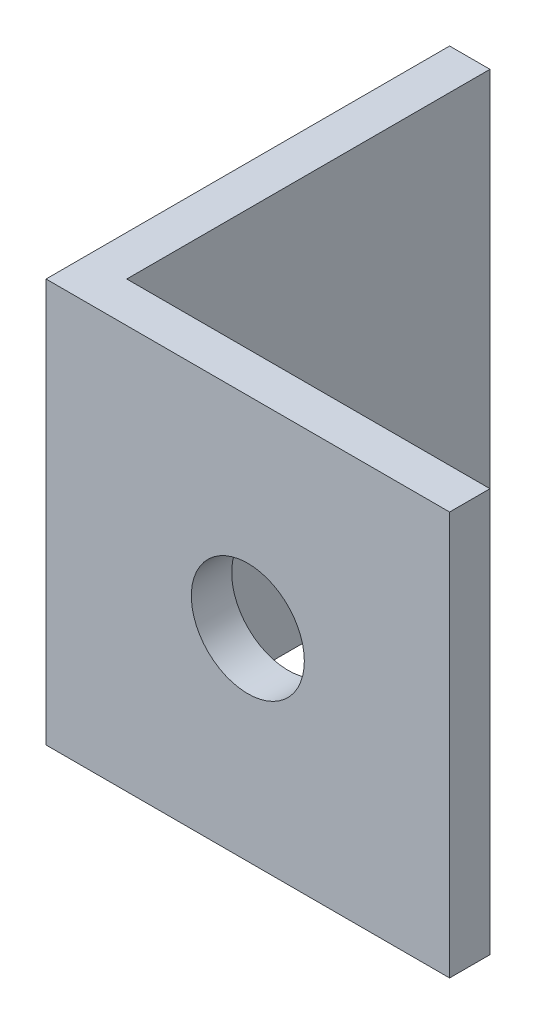
from build123d import *

# Parameters (mm, degrees)
SKETCH_1_W      = 50
SKETCH_1_H      = 50
SKETCH_1_R      = 7
EXTRUDE_1_DEPTH = 5
SKETCH_2_W      = 50
SKETCH_2_H      = 50
EXTRUDE_2_DEPTH = 5


with BuildPart() as part:
    # 草图1 → 凸台-拉伸1 (new body)
    with BuildSketch(Plane.XY):
        Rectangle(SKETCH_1_W, SKETCH_1_H)
        Circle(SKETCH_1_R, mode=Mode.SUBTRACT)
    extrude(amount=EXTRUDE_1_DEPTH)

    # 草图2 → 凸台-拉伸2 (add)
    with BuildSketch(Plane.ZY.offset(25)):
        with Locations((-20, 0)):
            Rectangle(SKETCH_2_W, SKETCH_2_H)
    extrude(amount=-EXTRUDE_2_DEPTH)


solid = part.part
